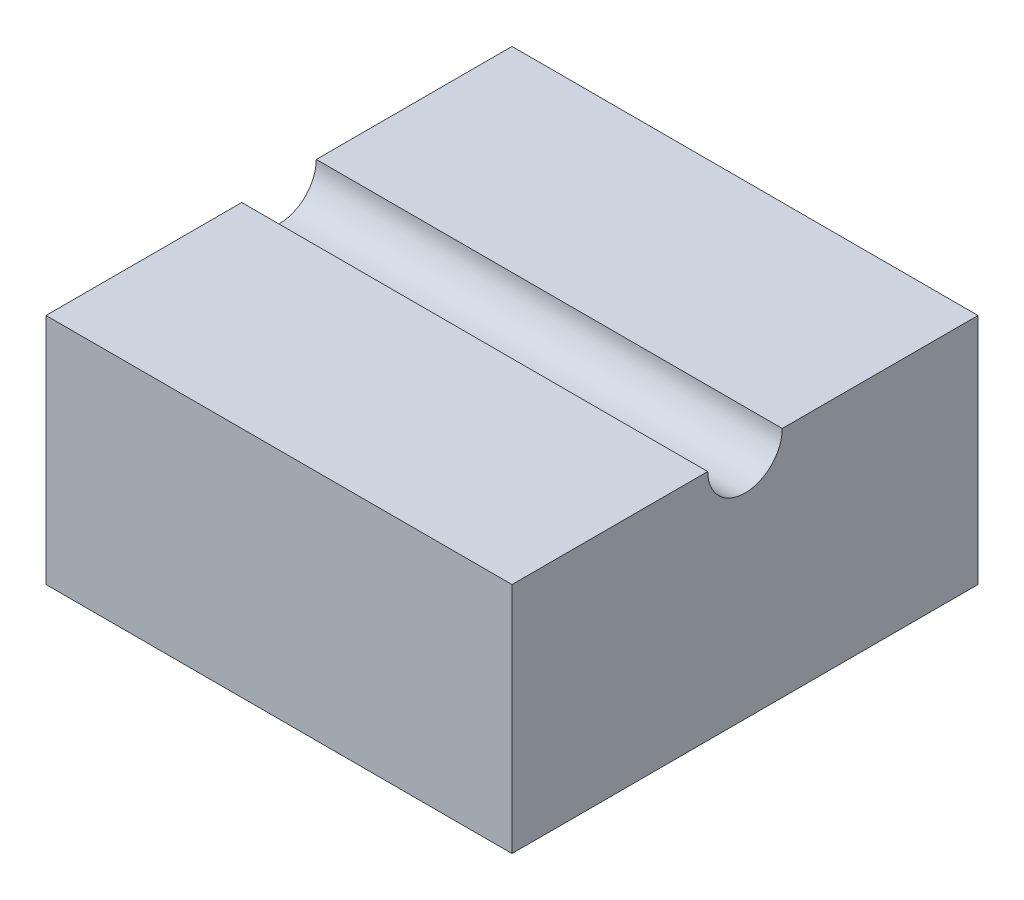
from build123d import *

# Parameters (mm, degrees)
SKETCH1_W           = 100
SKETCH1_H           = 100
BOSS_EXTRUDE1_DEPTH = 50
SKETCH2_R           = 8
CUT_EXTRUDE1_DEPTH  = 151


with BuildPart() as part:
    # Sketch1 → Boss-Extrude1 (new body)
    with BuildSketch(Plane(origin=(0, 0, 0), x_dir=(1, 0, 0), z_dir=(0, 1, 0))):
        with Locations((50, -50)):
            Rectangle(SKETCH1_W, SKETCH1_H)
    extrude(amount=BOSS_EXTRUDE1_DEPTH)

    # Sketch2 → Cut-Extrude1 (cut, through all)
    with BuildSketch(Plane(origin=(100, 0, 0), x_dir=(0, 0, -1), z_dir=(1, 0, 0))):
        with Locations((-50, 50)):
            Circle(SKETCH2_R)
    extrude(amount=-CUT_EXTRUDE1_DEPTH, mode=Mode.SUBTRACT)


solid = part.part
